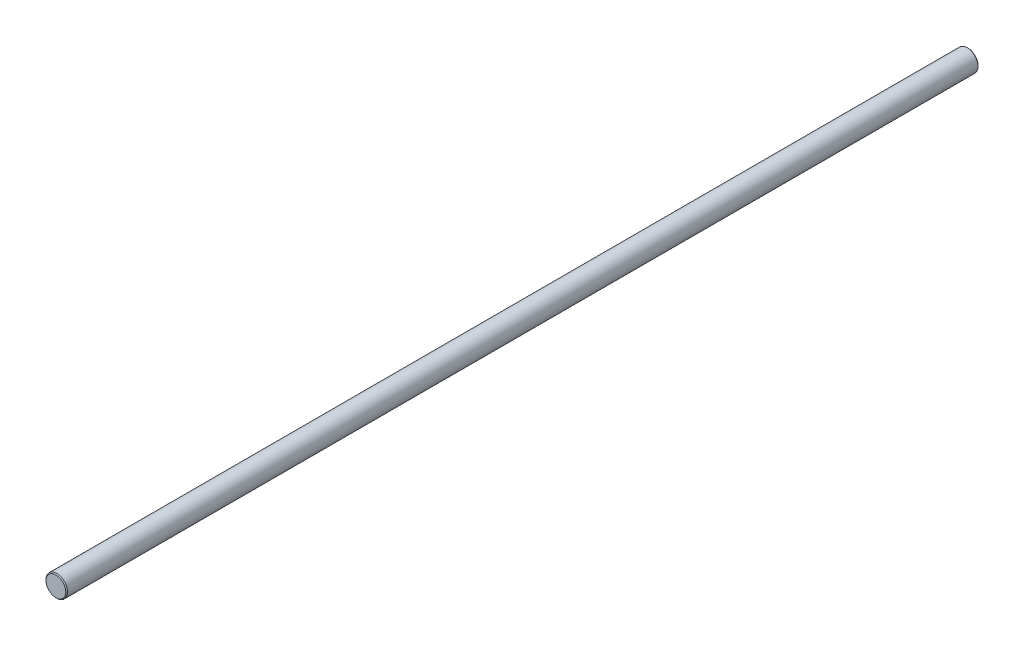
from build123d import *

# Parameters (mm, degrees)
SKETCH_1_R      = 12.5
EXTRUDE_1_DEPTH = 530
CHAMFER_1_SIZE  = 1


with BuildPart() as part:
    # Эскиз1 → Бобышка-Вытянуть1 (new, symmetric)
    with BuildSketch(Plane.XY):
        Circle(SKETCH_1_R)
    extrude(amount=EXTRUDE_1_DEPTH, both=True)

    # Фаска1
    chamfer_1_edges = [part.edges().sort_by_distance(p)[0] for p in [
        (-12.5, 0, -530),
        (-12.5, 0, 530),
    ]]
    chamfer(chamfer_1_edges, length=CHAMFER_1_SIZE)


solid = part.part
